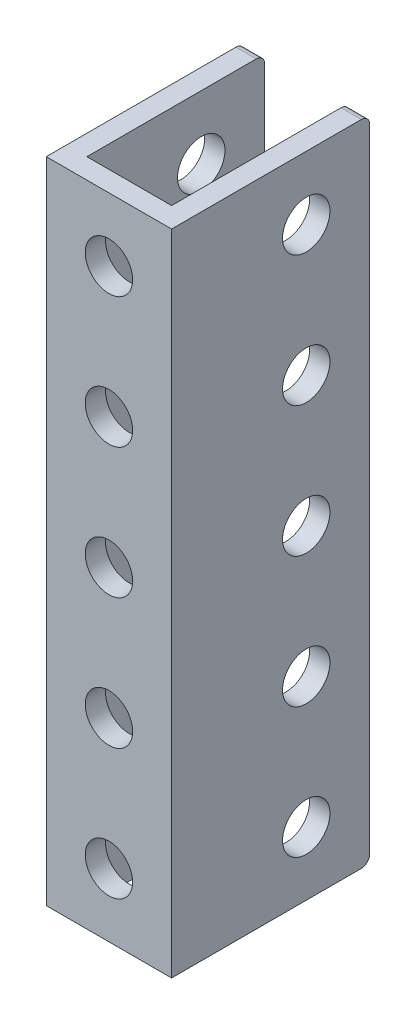
from build123d import *

# Parameters (mm, degrees)
SKETCH1_W                 = 48.641
SKETCH1_H                 = 14.859
BOSS_EXTRUDE1_DEPTH       = 9.398
SKETCH2_W                 = 6.35
SKETCH2_H                 = 13.335
CUT_EXTRUDE1_DEPTH        = 51.65421707
F_5_CLEARANCE_HOLE1_D     = 3.556
F_5_CLEARANCE_HOLE1_DEPTH = 1.524
F_5_CLEARANCE_HOLE2_D     = 3.556
F_5_CLEARANCE_HOLE2_DEPTH = 14.859
F_5_CLEARANCE_HOLE3_D     = 3.556
FILLET1_R                 = 0.635


with BuildPart() as part:
    # Sketch1 → Boss-Extrude1 (new body)
    with BuildSketch(Plane(origin=(-4.699, 0, 0), x_dir=(0, -1, 0), z_dir=(-1, 0, 0))):
        with Locations((-24.3205, -5.9055)):
            Rectangle(SKETCH1_W, SKETCH1_H)
    extrude(amount=-BOSS_EXTRUDE1_DEPTH)

    # Sketch2 → Cut-Extrude1 (cut, through all)
    with BuildSketch(Plane.XZ):
        with Locations((0, -6.6675)):
            Rectangle(SKETCH2_W, SKETCH2_H)
    extrude(amount=-CUT_EXTRUDE1_DEPTH, mode=Mode.SUBTRACT)

    # #5 Clearance Hole1
    with Locations(Plane(origin=(4.699, 0, 0), x_dir=(0, 0, -1), z_dir=(1, 0, 0))):
        with Locations((8.5725, 34.0995), (8.5725, 43.8785), (8.5725, 24.3205), (8.5725, 14.5415), (8.5725, 4.7625)):
            Hole(F_5_CLEARANCE_HOLE1_D / 2, depth=F_5_CLEARANCE_HOLE1_DEPTH)

    # #5 Clearance Hole2
    with Locations(Plane.XY.offset(1.524)):
        with Locations((0, 34.0995), (0, 43.8785), (0, 24.3205), (0, 14.5415), (0, 4.7625)):
            Hole(F_5_CLEARANCE_HOLE2_D / 2, depth=F_5_CLEARANCE_HOLE2_DEPTH)

    # #5 Clearance Hole3 (through all)
    with Locations(Plane(origin=(-3.175, 0, 0), x_dir=(0, 0, -1), z_dir=(1, 0, 0))):
        with Locations((8.5725, 34.0995), (8.5725, 43.8785), (8.5725, 24.3205), (8.5725, 14.5415), (8.5725, 4.7625)):
            Hole(F_5_CLEARANCE_HOLE3_D / 2)

    # Fillet1
    fillet1_edges = [part.edges().sort_by_distance(p)[0] for p in [
        (-3.937, 48.641, -13.335),
        (-3.937, 0, -13.335),
        (3.937, 0, -13.335),
        (3.937, 48.641, -13.335),
    ]]
    fillet(fillet1_edges, radius=FILLET1_R)


solid = part.part
